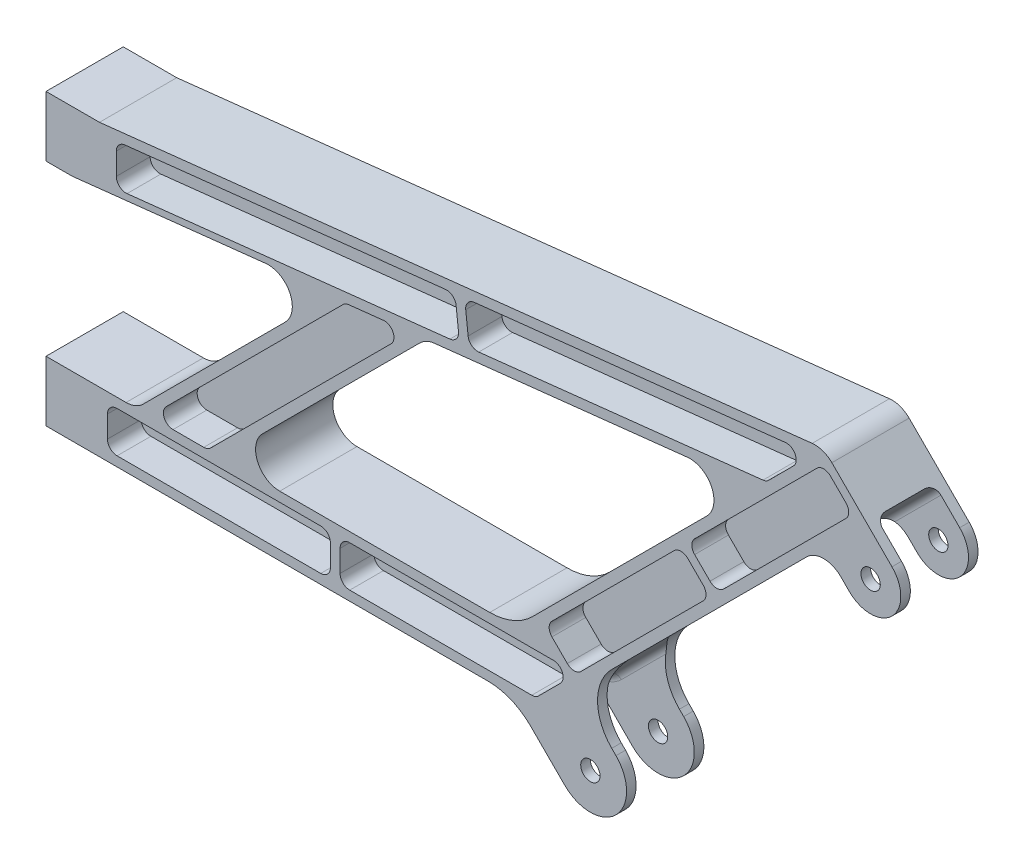
from build123d import *

# Parameters (mm, degrees)
SKETCH1_R               = 4.000000000000007
SKETCH1_R_2             = 4
BOSS_EXTRUDE1_DEPTH     = 32
CUT_EXTRUDE1_DEPTH      = 14
CUT_EXTRUDE2_DEPTH      = 12.0515
CUT_EXTRUDE2_DEPTH_BACK = 12.0515
FILLET1_R               = 4
FILLET2_R               = 4
SKETCH6_W               = 32
SKETCH6_H               = 25
BOSS_EXTRUDE2_DEPTH     = 0.440300703


with BuildPart() as part:
    # Sketch1 → Boss-Extrude1 (new body)
    with BuildSketch(Plane.XY):
        with BuildLine():
            Line((-16.049733998308586, 33.731487378633574), (8.839559805780222, 8.8381095989473))
            ThreePointArc((8.839559805780222, 8.8381095989473), (12.499999986501061, -0.00051272800107638), (8.838834762594171, -8.838834767069468))
            ThreePointArc((8.838834762594171, -8.838834767069468), (-1.5822419e-09, -12.500000000000004), (-8.838834764831827, -8.838834764831867))
            Line((-8.838834764831827, -8.838834764831867), (-12.374368671510593, -5.303300858153129))
            ThreePointArc((-12.374368671510593, -5.303300858153129), (-19.44543648337603, -2.3743686700186277), (-26.516504295241493, -5.303300858153101))
            Line((-26.516504295241493, -5.303300858153101), (-107.24873734525912, -86.0355339081699))
            ThreePointArc((-107.24873734525912, -86.0355339081699), (-113.10660172152828, -100.17766953190096), (-107.24873734525916, -114.31980515563204))
            Line((-107.24873734525916, -114.31980515563204), (-105.48097039229309, -116.0875721085981))
            ThreePointArc((-105.48097039229309, -116.0875721085981), (-101.08757211009126, -126.69417382639631), (-105.48097039229302, -137.30077554419455))
            ThreePointArc((-105.48097039229302, -137.30077554419455), (-116.0875721100912, -141.69417382639634), (-126.69417382788939, -137.3007755441946))
            Line((-126.69417382788939, -137.3007755441946), (-140.83255286115494, -123.16239651092909))
            ThreePointArc((-140.83255286115494, -123.16239651092909), (-148.94313658169136, -117.74307772781059), (-158.5102223908186, -115.84006604059276))
            Line((-158.5102223908186, -115.84006604059276), (-341.13730097225204, -115.84006604059276))
            Line((-341.13730097225204, -115.84006604059276), (-341.1373009722495, -90.84006604059275))
            Line((-341.1373009722495, -90.84006604059275), (-308.41236254138886, -90.84006604059275))
            ThreePointArc((-308.41236254138886, -90.84006604059275), (-304.585528217738, -90.07886136570562), (-301.34129472952344, -87.91113385245822))
            Line((-301.34129472952344, -87.91113385245822), (-242.48138395122018, -29.05122307415505))
            ThreePointArc((-242.48138395122018, -29.05122307415505), (-240.53681891966568, -17.653682746180582), (-250.6448259773551, -12.03999839350729))
            Line((-250.6448259773551, -12.03999839350729), (-330.17931975348506, -20.780446989330915))
            ThreePointArc((-330.17931975348506, -20.780446989330915), (-330.7246878836122, -20.825318129718745), (-331.27169396775446, -20.840290120548637))
            Line((-331.27169396775446, -20.840290120548637), (-341.5776016752601, -20.840290120548637))
            Line((-341.5776016752601, -20.840290120548637), (-341.5776016752601, 4.159709879451362))
            Line((-341.5776016752601, 4.159709879451362), (-319.4176016743681, 4.159709879451346))
            Line((-319.4176016743681, 4.159709879451346), (-24.213756083384812, 36.60115654207939))
            ThreePointArc((-24.213756083384812, 36.60115654207939), (-19.80525783014332, 36.09515683534142), (-16.049733998308586, 33.731487378633574))
        make_face()
        with Locations((-116.08757211009124, -126.69417382639637)):
            Circle(SKETCH1_R, mode=Mode.SUBTRACT)
        with Locations((-2.98344682e-09, -2.98341907e-09)):
            Circle(SKETCH1_R_2, mode=Mode.SUBTRACT)
        with BuildLine():
            Line((-157.76394759633592, -90.84006604059275), (-244.77275223459964, -90.84006604059276))
            ThreePointArc((-244.77275223459964, -90.84006604059276), (-254.0115475597125, -84.66690036424366), (-251.84382004646505, -73.76899822872734))
            Line((-251.84382004646505, -73.76899822872734), (-186.6917658288417, -8.616944011103918))
            ThreePointArc((-186.6917658288417, -8.616944011103918), (-183.94717053308534, -6.6723789795494355), (-180.71307223124595, -5.747854954187154))
            Line((-180.71307223124595, -5.747854954187154), (-75.9815909030455, 5.76161830015324))
            ThreePointArc((-75.9815909030455, 5.76161830015324), (-65.87358384535577, 0.14793394747996658), (-67.81814887691054, -11.249606380494681))
            Line((-67.81814887691054, -11.249606380494681), (-140.08627806667224, -83.51773557025643))
            ThreePointArc((-140.08627806667224, -83.51773557025643), (-148.1968617872087, -88.93705435337492), (-157.76394759633592, -90.84006604059275))
        make_face(mode=Mode.SUBTRACT)
    extrude(amount=BOSS_EXTRUDE1_DEPTH)

    # Sketch2 → Cut-Extrude1 (cut)
    with BuildSketch(Plane.XY.offset(32)):
        with BuildLine():
            Line((-308.8907187483117, 1.2924810307345336), (-176.10914312924507, 15.884521302439035))
            ThreePointArc((-176.10914312924507, 15.884521302439035), (-173.169662598149, 15.02892957191701), (-171.69613069602437, 12.345408240633859))
            Line((-171.69613069602437, 12.345408240633859), (-170.71299390318194, 3.399267058729826))
            ThreePointArc((-170.71299390318194, 3.399267058729826), (-171.56858563370398, 0.4597865276337294), (-174.25210696498712, -1.0137453744908707))
            Line((-174.25210696498712, -1.0137453744908707), (-308.01681937689534, -15.713827530830859))
            ThreePointArc((-308.01681937689534, -15.713827530830859), (-311.123244784273, -14.716673874145659), (-312.4537690626033, -11.737764783317964))
            Line((-312.4537690626033, -11.737764783317964), (-312.45376906260395, -2.6835817167783773))
            ThreePointArc((-312.45376906260395, -2.6835817167783773), (-311.4326781534316, -0.01410599510857757), (-308.8907187483117, 1.2924810307345336))
        make_face()
        with BuildLine():
            ThreePointArc((-167.7200679485115, 12.782357926341632), (-166.86447621798948, 15.721838457437718), (-164.18095488670633, 17.195370359562308))
            Line((-164.18095488670633, 17.195370359562308), (-35.277145984617704, 31.361263194511345))
            ThreePointArc((-35.277145984617704, 31.361263194511345), (-31.23394316154181, 29.115789453442037), (-32.01176917416371, 24.556773322252173))
            Line((-32.01176917416371, 24.556773322252173), (-42.183809278934454, 14.384733217481418))
            ThreePointArc((-42.183809278934454, 14.384733217481418), (-43.28164739723707, 13.606907204859585), (-44.575286717972915, 13.237097594714685))
            Line((-44.575286717972915, 13.237097594714685), (-162.32391872244838, 0.29710368263239556))
            ThreePointArc((-162.32391872244838, 0.29710368263239556), (-165.2633992535445, 1.1526954131544227), (-166.73693115566908, 3.8362167444375825))
            Line((-166.73693115566908, 3.8362167444375825), (-167.7200679485115, 12.782357926341632))
        make_face()
        with BuildLine():
            ThreePointArc((-288.9565184186731, -90.84006604059275), (-292.65203654871823, -88.37079977005311), (-291.78494554341927, -84.01163891584659))
            Line((-291.78494554341927, -84.01163891584659), (-218.56581541186782, -10.79250878429506))
            ThreePointArc((-218.56581541186782, -10.79250878429506), (-217.46797729356527, -10.014682771673263), (-216.1743379728295, -9.644873161528363))
            Line((-216.1743379728295, -9.644873161528363), (-201.8749878594985, -8.073445109555252))
            ThreePointArc((-201.8749878594985, -8.073445109555252), (-197.83178503642264, -10.318918850624499), (-198.60961104904442, -14.87793498181431))
            Line((-198.60961104904442, -14.87793498181431), (-273.40016923256906, -89.66849316533896))
            ThreePointArc((-273.40016923256906, -89.66849316533896), (-274.6978626278549, -90.53558417063789), (-276.2285963573152, -90.84006604059276))
            Line((-276.2285963573152, -90.84006604059276), (-288.9565184186731, -90.84006604059275))
        make_face()
        with BuildLine():
            ThreePointArc((-72.89302846182751, -27.638194464396573), (-74.06460133708134, -24.809767339650364), (-72.89302846182751, -21.981340214904154))
            Line((-72.89302846182751, -21.981340214904154), (-22.27200736402945, 28.63968088289363))
            ThreePointArc((-22.27200736402945, 28.63968088289363), (-19.44341616830374, 29.811253754782516), (-16.614921092650253, 28.639448841971976))
            Line((-16.614921092650253, 28.639448841971976), (-10.251482132632672, 22.27496574063185))
            ThreePointArc((-10.251482132632672, 22.27496574063185), (-9.080141282630589, 19.44660658582777), (-10.251714154519505, 16.618343532061086))
            Line((-10.251714154519505, 16.618343532061086), (-60.872213181656655, -34.00215549507506))
            ThreePointArc((-60.872213181656655, -34.00215549507506), (-63.70064030640285, -35.17372837032886), (-66.52906743114904, -34.00215549507503))
            Line((-66.52906743114904, -34.00215549507503), (-72.89302846182751, -27.638194464396573))
        make_face()
        with BuildLine():
            ThreePointArc((-69.35749455589527, -36.83058261982118), (-68.18592168064143, -39.6590097445674), (-69.35749455589527, -42.48743686931361))
            Line((-69.35749455589527, -42.48743686931361), (-119.97665940661716, -93.10660172003546))
            ThreePointArc((-119.97665940661716, -93.10660172003546), (-122.80508653136334, -94.27817459528924), (-125.63351365610953, -93.10660172003544))
            Line((-125.63351365610953, -93.10660172003544), (-131.997474686788, -86.74264068935697))
            ThreePointArc((-131.997474686788, -86.74264068935697), (-133.1690475620418, -83.91421356461078), (-131.99747468678797, -81.08578643986458))
            Line((-131.99747468678797, -81.08578643986458), (-81.37830983606611, -30.466621589142765))
            ThreePointArc((-81.37830983606611, -30.466621589142765), (-78.54988271131991, -29.29504871388893), (-75.7214555865737, -30.466621589142765))
            Line((-75.7214555865737, -30.466621589142765), (-69.35749455589527, -36.83058261982118))
        make_face()
        with BuildLine():
            ThreePointArc((-219.77002163708093, -98.84006604059284), (-218.59844876182711, -96.01163891584663), (-215.7700216370809, -94.8400660405928))
            Line((-215.7700216370809, -94.8400660405928), (-131.36697797666707, -94.84006604059279))
            ThreePointArc((-131.36697797666707, -94.84006604059279), (-127.67145984662183, -97.30933231113245), (-128.53855085192086, -101.66849316533907))
            Line((-128.53855085192086, -101.66849316533907), (-137.53855085192086, -110.66849316533893))
            ThreePointArc((-137.53855085192086, -110.66849316533893), (-138.83624424720668, -111.5355841706379), (-140.36697797666704, -111.84006604059275))
            Line((-140.36697797666704, -111.84006604059275), (-215.7700216370809, -111.84006604059277))
            ThreePointArc((-215.7700216370809, -111.84006604059277), (-218.59844876182711, -110.66849316533894), (-219.77002163708093, -107.84006604059273))
            Line((-219.77002163708093, -107.84006604059273), (-219.77002163708093, -98.84006604059284))
        make_face()
        with BuildLine():
            Line((-223.77002163708121, -98.84006604059284), (-223.77002163708121, -107.84006604059273))
            ThreePointArc((-223.77002163708121, -107.84006604059273), (-224.94159451233503, -110.66849316533894), (-227.77002163708124, -111.84006604059277))
            Line((-227.77002163708124, -111.84006604059277), (-312.1373009722494, -111.84006604059275))
            ThreePointArc((-312.1373009722494, -111.84006604059275), (-314.96572809699563, -110.66849316533893), (-316.1373009722494, -107.84006604059273))
            Line((-316.1373009722494, -107.84006604059273), (-316.1373009722494, -98.84006604059279))
            ThreePointArc((-316.1373009722494, -98.84006604059279), (-314.96572809699563, -96.0116389158466), (-312.1373009722494, -94.84006604059279))
            Line((-312.1373009722494, -94.84006604059279), (-227.77002163708124, -94.8400660405928))
            ThreePointArc((-227.77002163708124, -94.8400660405928), (-224.94159451233503, -96.01163891584663), (-223.77002163708121, -98.84006604059284))
        make_face()
    cut_extrude1 = extrude(amount=-CUT_EXTRUDE1_DEPTH, mode=Mode.SUBTRACT)

    # Mirror1: Cut-Extrude1 across plane
    add(cut_extrude1.mirror(Plane.XY.offset(16)), mode=Mode.SUBTRACT)

    # Sketch3 → Cut-Extrude2 (cut, two sides: drawn at the far end of the back side and taken through both)
    with BuildSketch(Plane.XY.offset(16).offset(-CUT_EXTRUDE2_DEPTH_BACK)):
        with BuildLine():
            Line((-158.5102223908186, -115.84006604059276), (-141.19540510141326, -115.84006604059277))
            ThreePointArc((-141.19540510141326, -115.84006604059277), (-137.3685707777624, -115.07886136570563), (-134.1243372895478, -112.91113385245826))
            Line((-134.1243372895478, -112.91113385245826), (-98.96898095039894, -77.75577751330981))
            Line((-98.96898095039894, -77.75577751330981), (-66.35974339813797, -110.01855027197146))
            Line((-66.35974339813797, -110.01855027197146), (-116.59713847003755, -149.21856691920738))
            Line((-116.59713847003755, -149.21856691920738), (-158.5102223908186, -115.84006604059276))
        make_face()
        Polygon((-29.015558543217246, -7.8023551061288385), (7.8698142046997255, 29.08301764178775), (26.353299234567167, -15.387889096839226), (-12.041020580309814, -17.81897048249737), align=None)
    extrude(amount=CUT_EXTRUDE2_DEPTH + CUT_EXTRUDE2_DEPTH_BACK, mode=Mode.SUBTRACT)

    # Fillet1
    fillet1_edges = [part.edges().sort_by_distance(p)[0] for p in [
        (-14.141700563915723, 7.07150287317253, 3.9484999999999992),
        (-14.141700563915723, 7.07150287317253, 28.0515),
    ]]
    fillet(fillet1_edges, radius=FILLET1_R)

    # Fillet2
    fillet2_edges = [part.edges().sort_by_distance(p)[0] for p in [
        (-120.68653731740346, -99.47333388031407, 3.9484999999999992),
        (-120.68653731740346, -99.47333388031407, 28.0515),
        (-137.3685707777624, -115.07886136570563, 28.0515),
        (-149.85281374611594, -115.84006604059277, 28.0515),
        (-137.3685707777624, -115.07886136570563, 3.9484999999999992),
        (-149.85281374611594, -115.84006604059277, 3.9484999999999992),
    ]]
    fillet(fillet2_edges, radius=FILLET2_R)

    # Sketch6 → Boss-Extrude2 (add)
    with BuildSketch(Plane.ZY.offset(341.1373009722402)):
        with Locations((16, -103.34006604062759)):
            Rectangle(SKETCH6_W, SKETCH6_H)
    extrude(amount=BOSS_EXTRUDE2_DEPTH)


solid = part.part
